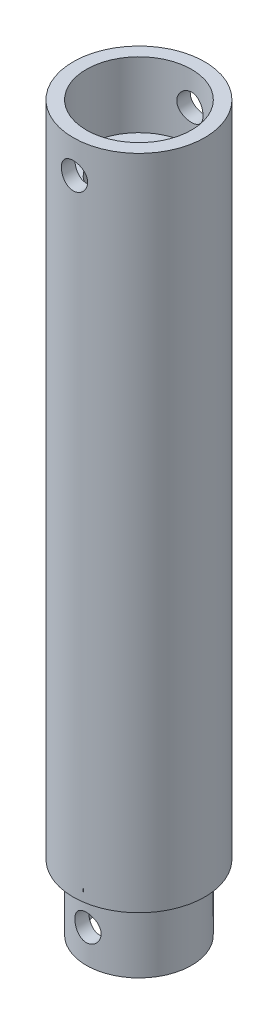
from build123d import *

# Parameters (mm, degrees)
SKETCH2_R           = 7.9
BOSS_EXTRUDE1_DEPTH = 5
SKETCH3_R           = 10
BOSS_EXTRUDE2_DEPTH = 100
SKETCH4_R           = 6
CUT_EXTRUDE2_DEPTH  = 200
SKETCH5_R           = 8
BOSS_EXTRUDE3_DEPTH = 5
CUT_EXTRUDE3_START  = -5
SKETCH6_R           = 6
CUT_EXTRUDE3_DEPTH  = 5
BOSS_EXTRUDE5_START = 5
SKETCH10_R          = 8
BOSS_EXTRUDE5_DEPTH = 5
CUT_EXTRUDE5_START  = -10
SKETCH11_R          = 6
CUT_EXTRUDE5_DEPTH  = 10
SKETCH12_R          = 2
CUT_EXTRUDE6_DEPTH  = 20
SKETCH13_R          = 2
CUT_EXTRUDE7_DEPTH  = 20
CUT_EXTRUDE9_START  = -10
SKETCH15_R          = 8
CUT_EXTRUDE9_DEPTH  = 10


with BuildPart() as part:
    # Sketch2 → Boss-Extrude1 (new body)
    with BuildSketch(Plane(origin=(0, 0, 0), x_dir=(1, 0, 0), z_dir=(0, 1, 0))):
        with Locations(Location((0, 0, 0), (0, 0, 270))):
            Circle(SKETCH2_R)
    extrude(amount=BOSS_EXTRUDE1_DEPTH)

    # Sketch3 → Boss-Extrude2 (add)
    with BuildSketch(Plane(origin=(0, 5, 0), x_dir=(1, 0, 0), z_dir=(0, 1, 0))):
        with Locations(Location((0, 0, 0), (0, 0, 270))):
            Circle(SKETCH3_R)
    extrude(amount=BOSS_EXTRUDE2_DEPTH)

    # Sketch4 → Cut-Extrude2 (cut)
    with BuildSketch(Plane(origin=(0, 105, 0), x_dir=(1, 0, 0), z_dir=(0, 1, 0))):
        with Locations(Location((0, 0, 0), (0, 0, 270))):
            Circle(SKETCH4_R)
    extrude(amount=-CUT_EXTRUDE2_DEPTH, mode=Mode.SUBTRACT)

    # Sketch5 → Boss-Extrude3 (add)
    with BuildSketch(Plane(origin=(0, 0, 0), x_dir=(-1, 0, 0), z_dir=(0, -1, 0))):
        with Locations(Location((0, 0, 0), (0, 0, 90))):
            Circle(SKETCH5_R)
    extrude(amount=-BOSS_EXTRUDE3_DEPTH)

    # Sketch6 → Cut-Extrude3 (cut)
    with BuildSketch(Plane(origin=(0, 0, 0), x_dir=(-1, 0, 0), z_dir=(0, -1, 0)).offset(CUT_EXTRUDE3_START)):
        with Locations(Location((0, 0, 0), (0, 0, 270))):
            Circle(SKETCH6_R)
    extrude(amount=CUT_EXTRUDE3_DEPTH, mode=Mode.SUBTRACT)

    # Sketch10 → Boss-Extrude5 (add)
    with BuildSketch(Plane(origin=(0, 0, 0), x_dir=(-1, 0, 0), z_dir=(0, -1, 0)).offset(BOSS_EXTRUDE5_START)):
        with Locations(Location((0, 0, 0), (0, 0, 90))):
            Circle(SKETCH10_R)
    extrude(amount=-BOSS_EXTRUDE5_DEPTH)

    # Sketch11 → Cut-Extrude5 (cut)
    with BuildSketch(Plane(origin=(0, -5, 0), x_dir=(-1, 0, 0), z_dir=(0, -1, 0)).offset(CUT_EXTRUDE5_START)):
        with Locations(Location((0, 0, 0), (0, 0, 270))):
            Circle(SKETCH11_R)
    extrude(amount=CUT_EXTRUDE5_DEPTH, mode=Mode.SUBTRACT)

    # Sketch12 → Cut-Extrude6 (cut)
    with BuildSketch(Plane.XY.offset(10)):
        Circle(SKETCH12_R)
    extrude(amount=-CUT_EXTRUDE6_DEPTH, mode=Mode.SUBTRACT)

    # Sketch13 → Cut-Extrude7 (cut)
    with BuildSketch(Plane.XY.offset(10)):
        with Locations(Location((0, 100, 0), (0, 0, 270.000000021))):
            Circle(SKETCH13_R)
    extrude(amount=-CUT_EXTRUDE7_DEPTH, mode=Mode.SUBTRACT)

    # Sketch15 → Cut-Extrude9 (cut)
    with BuildSketch(Plane(origin=(0, 105, 0), x_dir=(1, 0, 0), z_dir=(0, 1, 0)).offset(CUT_EXTRUDE9_START)):
        with Locations(Location((0, 0, 0), (0, 0, 90))):
            Circle(SKETCH15_R)
    extrude(amount=CUT_EXTRUDE9_DEPTH, mode=Mode.SUBTRACT)


solid = part.part
